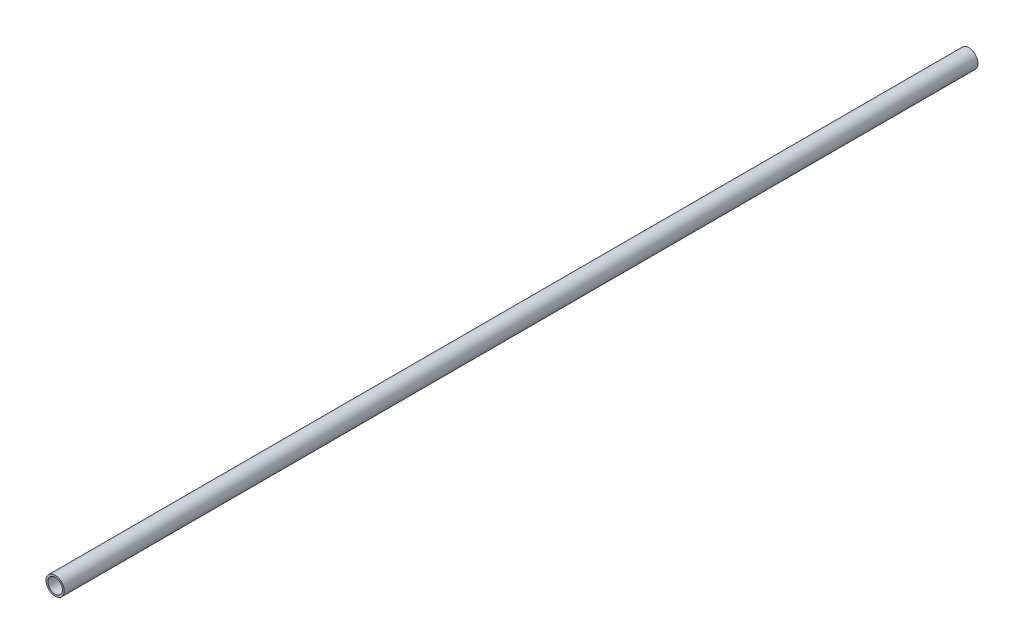
from build123d import *

# Parameters (mm, degrees)
SKETCH_1_R      = 25
SKETCH_1_R_2    = 20
EXTRUDE_1_DEPTH = 2500


with BuildPart() as part:
    # 草圖1 → 填料-伸長1 (new body)
    with BuildSketch(Plane.XY):
        Circle(SKETCH_1_R)
        Circle(SKETCH_1_R_2, mode=Mode.SUBTRACT)
    extrude(amount=EXTRUDE_1_DEPTH)


solid = part.part
